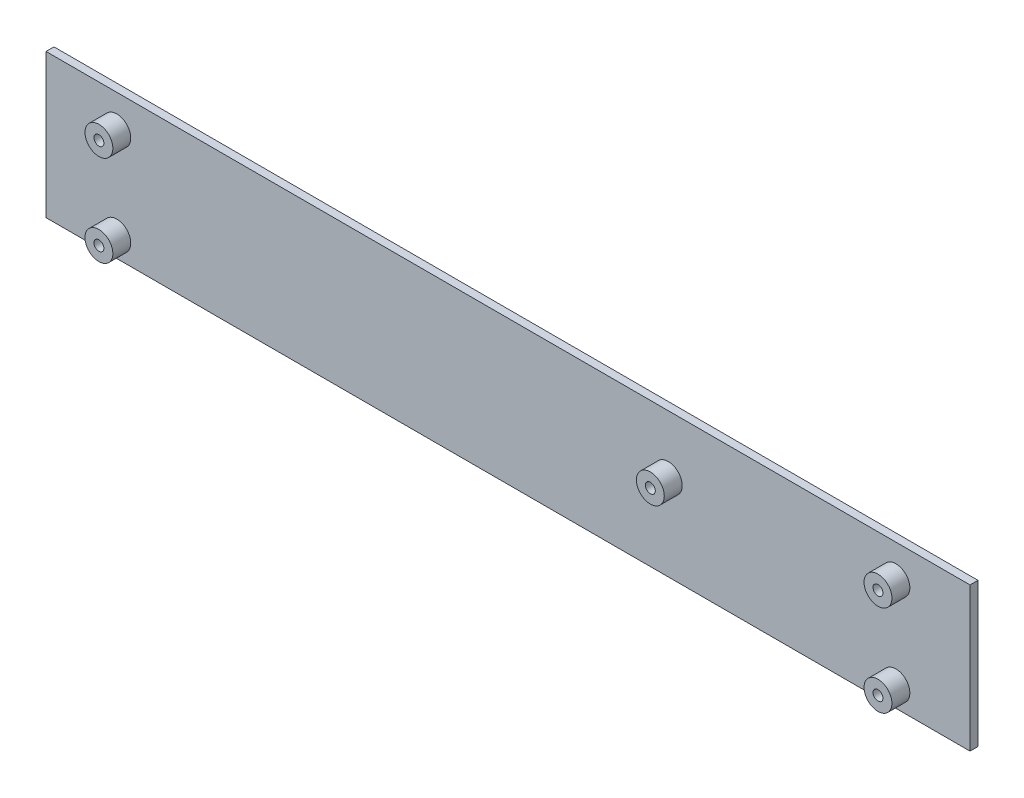
from build123d import *

# Parameters (mm, degrees)
BOSS_EXTRUDE1_START         = 4.5
SKETCH2_W                   = 231.966777064
SKETCH2_H                   = 36.14
BOSS_EXTRUDE1_DEPTH         = 2
SKETCH3_R                   = 3.5
BOSS_EXTRUDE2_DEPTH         = 4.5
TAP_DRILL_FOR_M3X0_5_TAP1_D = 2.5


with BuildPart() as part:
    # Sketch2 → Boss-Extrude1 (new body)
    with BuildSketch(Plane(origin=(0, 0, -1.6), x_dir=(-1, 0, 0), z_dir=(0, 0, -1)).offset(BOSS_EXTRUDE1_START)):
        with Locations((-174.403388532, -55.59)):
            Rectangle(SKETCH2_W, SKETCH2_H)
    extrude(amount=BOSS_EXTRUDE1_DEPTH)

    # Sketch3 → Boss-Extrude2 (add)
    with BuildSketch(Plane.XY.offset(-6.1)):
        with Locations(Location((271.78, -45.72, 0), (0, 0, 180))):
            Circle(SKETCH3_R)
        with Locations(Location((271.78, -68.58, 0), (0, 0, 180))):
            Circle(SKETCH3_R)
        with Locations(Location((214.63, -52.07, 0), (0, 0, 180))):
            Circle(SKETCH3_R)
        with Locations(Location((76.2, -45.72, 0), (0, 0, 180))):
            Circle(SKETCH3_R)
        with Locations(Location((76.2, -68.58, 0), (0, 0, 180))):
            Circle(SKETCH3_R)
    extrude(amount=BOSS_EXTRUDE2_DEPTH)

    # Tap Drill for M3x0.5 Tap1 (through all)
    with Locations(Plane.XY.offset(-1.6)):
        with Locations((271.78, -45.72), (271.78, -68.58), (214.63, -52.07), (76.2, -45.72), (76.2, -68.58)):
            Hole(TAP_DRILL_FOR_M3X0_5_TAP1_D / 2)


solid = part.part
